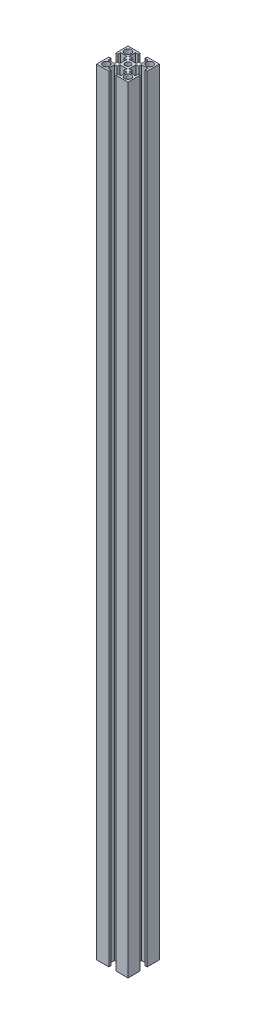
from build123d import *

# Parameters (mm, degrees)
SKETCH_1_R      = 2.15
SKETCH_1_R_2    = 1.75
EXTRUDE_1_DEPTH = 495


with BuildPart() as part:
    # 草图1 → 凸台-拉伸1 (new body)
    # profile 1 of 5: a face of its own
    with BuildSketch(Plane(origin=(0, 0, 0), x_dir=(1, 0, 0), z_dir=(0, 1, 0))):
        Polygon((-2.2, 8.7), (-2.2, 10), (-10, 10), (-10, 2.2), (-8.7, 2.2), (-8.7, 4.05), (-4.7, 4.05), (-4.7, 2.2), (-2.95, 2.2), (-2.95, 2.95), (-2.2, 2.95), (-2.2, 4.7), (-4.05, 4.7), (-4.05, 8.7), align=None)
        with Locations(Location((-6.9, 6.9, 0), (0, 0, 270))):
            Circle(SKETCH_1_R, mode=Mode.SUBTRACT)
    # profile 2 of 5: a face of its own
    with BuildSketch(Plane(origin=(0, 0, 0), x_dir=(1, 0, 0), z_dir=(0, 1, 0))):
        Polygon((2.2, 2.95), (-2.2, 2.95), (-2.95, 2.95), (-2.95, 2.2), (-2.95, -2.2), (-2.95, -2.95), (-2.2, -2.95), (2.2, -2.95), (2.95, -2.95), (2.95, -2.2), (2.95, 2.2), (2.95, 2.95), align=None)
        with Locations(Location((0, 0, 0), (0, 0, 270))):
            Circle(SKETCH_1_R_2, mode=Mode.SUBTRACT)
    # profile 3 of 5: a face of its own
    with BuildSketch(Plane(origin=(0, 0, 0), x_dir=(1, 0, 0), z_dir=(0, 1, 0))):
        Polygon((-8.7, -2.2), (-10, -2.2), (-10, -10), (-2.2, -10), (-2.2, -8.7), (-4.05, -8.7), (-4.05, -4.7), (-2.2, -4.7), (-2.2, -2.95), (-2.95, -2.95), (-2.95, -2.2), (-4.7, -2.2), (-4.7, -4.05), (-8.7, -4.05), align=None)
        with Locations(Location((-6.9, -6.9, 0), (0, 0, 270))):
            Circle(SKETCH_1_R, mode=Mode.SUBTRACT)
    # profile 4 of 5: a face of its own
    with BuildSketch(Plane(origin=(0, 0, 0), x_dir=(1, 0, 0), z_dir=(0, 1, 0))):
        Polygon((10, -10), (10, -2.2), (8.7, -2.2), (8.7, -4.05), (4.7, -4.05), (4.7, -2.2), (2.95, -2.2), (2.95, -2.95), (2.2, -2.95), (2.2, -4.7), (4.05, -4.7), (4.05, -8.7), (2.2, -8.7), (2.2, -10), align=None)
        with Locations(Location((6.9, -6.9, 0), (0, 0, 270))):
            Circle(SKETCH_1_R, mode=Mode.SUBTRACT)
    # profile 5 of 5: a face of its own
    with BuildSketch(Plane(origin=(0, 0, 0), x_dir=(1, 0, 0), z_dir=(0, 1, 0))):
        Polygon((10, 10), (2.2, 10), (2.2, 8.7), (4.05, 8.7), (4.05, 4.7), (2.2, 4.7), (2.2, 2.95), (2.95, 2.95), (2.95, 2.2), (4.7, 2.2), (4.7, 4.05), (8.7, 4.05), (8.7, 2.2), (10, 2.2), align=None)
        with Locations(Location((6.9, 6.9, 0), (0, 0, 270))):
            Circle(SKETCH_1_R, mode=Mode.SUBTRACT)
    extrude(amount=-EXTRUDE_1_DEPTH)


solid = part.part
